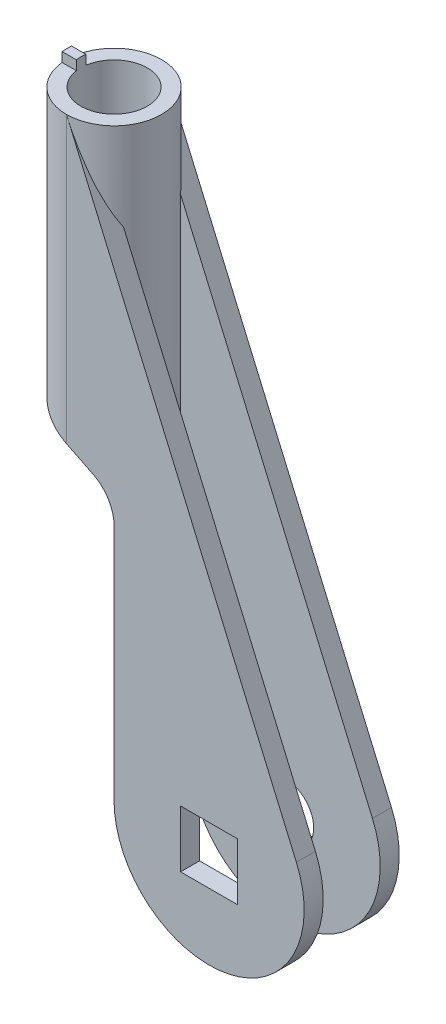
from build123d import *

# Parameters (mm, degrees)
SKETCH1_R             = 3
BOSS_EXTRUDE1_DEPTH   = 2
SKETCH2_R             = 3
BOSS_EXTRUDE2_DEPTH   = 2
SKETCH3_R             = 5
CUT_EXTRUDE1_DEPTH    = 38
BOSS_EXTRUDE3_DEPTH   = 35
CUT_EXTRUDE2_DEPTH    = 13
SKETCH6_R             = 3.5
CUT_EXTRUDE3_DEPTH    = 42
SKETCH7_W             = 6
SKETCH7_H             = 6
CUT_EXTRUDE4_DEPTH    = 5
BODY_MOVE_COPY1_ANGLE = 90
BODY_MOVE_COPY2_ANGLE = 45
BODY_MOVE_COPY3_ANGLE = 45
CUT_EXTRUDE5_DEPTH    = 10
BOSS_EXTRUDE4_START   = 1
BOSS_EXTRUDE4_DEPTH   = 1


with BuildPart() as part:
    # Sketch1 → Boss-Extrude1 (new body)
    with BuildSketch(Plane.XY):
        with BuildLine():
            Line((10, 0), (10, 25))
            Line((10, 25), (10, 25.027864045))
            ThreePointArc((10, 25.027864045), (10.597396767, 27.130788493), (12.211145618, 28.605572809))
            Line((12.211145618, 28.605572809), (15, 30))
            Line((15, 30), (15, 60))
            Line((15, 60), (-9.181612248, 3.962069729))
            ThreePointArc((-9.181612248, 3.962069729), (-2.022854113, -9.793266117), (10, 0))
        make_face()
        Circle(SKETCH1_R, mode=Mode.SUBTRACT)
    extrude(amount=BOSS_EXTRUDE1_DEPTH)


with BuildPart() as body_2:
    # Sketch2 → Boss-Extrude2 (new body)
    with BuildSketch(Plane.XY.offset(8)):
        with BuildLine():
            Line((10, 0), (10, 25.027864045))
            Line((10, 25.027864045), (10, 25.043361255))
            ThreePointArc((10, 25.043361255), (10.602103374, 27.153882167), (12.22714926, 28.629027198))
            Line((12.22714926, 28.629027198), (15, 30))
            Line((15, 30), (15, 60))
            Line((15, 60), (-9.181612248, 3.962069729))
            ThreePointArc((-9.181612248, 3.962069729), (-2.022854113, -9.793266117), (10, 0))
        make_face()
        Circle(SKETCH2_R, mode=Mode.SUBTRACT)
    extrude(amount=BOSS_EXTRUDE2_DEPTH)


with BuildPart() as cut_extrude1_tool:
    # Sketch3 → Cut-Extrude1 (new body)
    with BuildSketch(Plane(origin=(0, 60, 0), x_dir=(1, 0, 0), z_dir=(0, 1, 0))):
        with Locations((15, -5)):
            Circle(SKETCH3_R)
    extrude(amount=-CUT_EXTRUDE1_DEPTH)


with BuildPart() as part_1:
    add(part.part)

    # Cut-Extrude1: cut by cut_extrude1_tool
    add(cut_extrude1_tool.part, mode=Mode.SUBTRACT)



with BuildPart() as body_2_1:
    add(body_2.part)

    # Cut-Extrude1: cut by cut_extrude1_tool
    add(cut_extrude1_tool.part, mode=Mode.SUBTRACT)


with BuildPart() as part_2:
    add(part_1.part)

    add(body_2_1.part)  # Boss-Extrude3 merges body 2
    # Sketch4 → Boss-Extrude3 (add)
    with BuildSketch(Plane(origin=(0, 60, 0), x_dir=(1, 0, 0), z_dir=(0, 1, 0))):
        with BuildLine():
            ThreePointArc((15, 0), (10, -5), (15, -10))
            Line((15, -10), (15, 0))
        make_face()
        with BuildLine():
            Line((15, 0), (15, -10))
            ThreePointArc((15, -10), (18.535533906, -8.535533906), (20, -5))
            ThreePointArc((20, -5), (18.535533906, -1.464466094), (15, 0))
        make_face()
    extrude(amount=-BOSS_EXTRUDE3_DEPTH)

    # Sketch5 → Cut-Extrude2 (cut)
    with BuildSketch(Plane.XY):
        with BuildLine():
            Line((10, 25.027864045), (10, 25.043361255))
            ThreePointArc((10, 25.043361255), (10.602103374, 27.153882167), (12.22714926, 28.629027198))
            Line((12.22714926, 28.629027198), (15, 30))
            Line((15, 30), (20, 32.472135955))
            Line((20, 32.472135955), (20, 25))
            Line((20, 25), (20, 22.63115285))
            Line((20, 22.63115285), (10, 22.63115285))
            Line((10, 22.63115285), (10, 25.027864045))
        make_face()
    extrude(amount=CUT_EXTRUDE2_DEPTH, mode=Mode.SUBTRACT)

    # Sketch6 → Cut-Extrude3 (cut)
    with BuildSketch(Plane(origin=(0, 60, 0), x_dir=(1, 0, 0), z_dir=(0, 1, 0))):
        with Locations(Location((15, -5, 0), (0, 0, 270))):
            Circle(SKETCH6_R)
    extrude(amount=-CUT_EXTRUDE3_DEPTH, mode=Mode.SUBTRACT)

    # Sketch7 → Cut-Extrude4 (cut)
    with BuildSketch(Plane(origin=(0, 0, 0), x_dir=(-1, 0, 0), z_dir=(0, 0, -1))):
        Rectangle(SKETCH7_W, SKETCH7_H)
    extrude(amount=-CUT_EXTRUDE4_DEPTH, mode=Mode.SUBTRACT)


with BuildPart() as part_3:
    # Body-Move/Copy1: moved
    add(part_2.part.rotate(Axis((5, 0, 5), (0, 1, 0)), BODY_MOVE_COPY1_ANGLE))


with BuildPart() as part_4:
    # Body-Move/Copy2: moved
    add(part_3.part.rotate(Axis((5, 0, 5), (0, 1, 0)), BODY_MOVE_COPY2_ANGLE))


with BuildPart() as part_5:
    # Body-Move/Copy3: moved
    add(part_4.part.rotate(Axis((6.035533906, 0, 6.035533906), (0, 1, 0)), BODY_MOVE_COPY3_ANGLE))

    # Sketch8 → Cut-Extrude5 (cut)
    with BuildSketch(Plane(origin=(0, 0, 0), x_dir=(0, 0, -1), z_dir=(1, 0, 0))):
        Polygon((-3.035533906, 27.346279357), (-5.863961031, 30.174706482), (-9.035533906, 27.346279357), (-6.035533906, 25.043361255), align=None)
    extrude(amount=-CUT_EXTRUDE5_DEPTH, mode=Mode.SUBTRACT)

    # Sketch11 → Boss-Extrude4 (add)
    with BuildSketch(Plane(origin=(0, 60, 0), x_dir=(1, 0, 0), z_dir=(0, 1, 0)).offset(BOSS_EXTRUDE4_START)):
        with BuildLine():
            Line((-10.403869374, -5.535533906), (-10.403869374, -6.535533906))
            Line((-10.403869374, -6.535533906), (-8.893033803, -6.535533906))
            ThreePointArc((-8.893033803, -6.535533906), (-8.928932188, -6.035533906), (-8.893033803, -5.535533906))
            Line((-8.893033803, -5.535533906), (-10.403869374, -5.535533906))
        make_face()
    extrude(amount=-BOSS_EXTRUDE4_DEPTH)


solid = part_5.part
